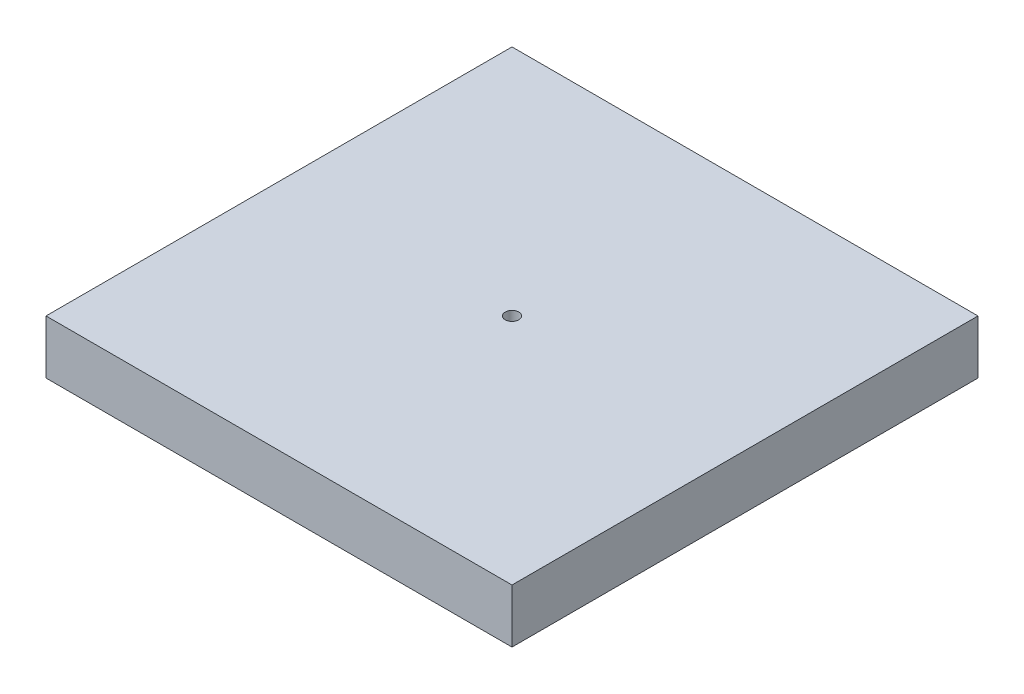
from build123d import *

# Parameters (mm, degrees)
SKETCH1_W           = 220
SKETCH1_H           = 220
BOSS_EXTRUDE1_DEPTH = 25.4
SKETCH2_R           = 3.2
CUT_EXTRUDE1_DEPTH  = 25.4


with BuildPart() as part:
    # Sketch1 → Boss-Extrude1 (new body)
    with BuildSketch(Plane(origin=(0, 0, 0), x_dir=(1, 0, 0), z_dir=(0, 1, 0))):
        with Locations((13.194090539, -14.502705466)):
            Rectangle(SKETCH1_W, SKETCH1_H)
    extrude(amount=BOSS_EXTRUDE1_DEPTH)

    # Sketch2 → Cut-Extrude1 (cut)
    with BuildSketch(Plane(origin=(0, 25.4, 0), x_dir=(1, 0, 0), z_dir=(0, 1, 0))):
        with Locations(Location((13.194090539, -14.502705466, 0), (0, 0, 270))):
            Circle(SKETCH2_R)
    extrude(amount=-CUT_EXTRUDE1_DEPTH, mode=Mode.SUBTRACT)


solid = part.part
